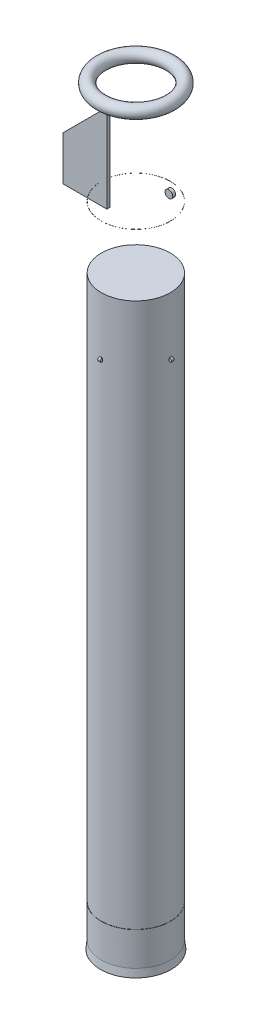
from build123d import *

# Parameters (mm, degrees)
SKETCH6_R             = 220
BOSS_EXTRUDE1_DEPTH   = 160
CIRPATTERN1_COUNT     = 4
SKETCH8_R             = 500
BOSS_EXTRUDE2_DEPTH   = 190
BOSS_EXTRUDE2_2_DEPTH = 190
SKETCH10_R            = 10
SKETCH10_R_2          = 6
SKETCH10_R_3          = 800


with BuildPart() as part:
    # Sketch1 → Revolve1 (revolve)
    with BuildSketch(Plane.XY, mode=Mode.PRIVATE) as revolve1_sk:
        Polygon((0, 76500), (4500, 76500), (4500, 1000), (4620, 0), (4300, 0), (4300, 1500), (4300, 73000), (0, 75000), align=None)
    revolve(revolve1_sk.sketch.rotate(Axis((0, 0, 0), (0, 1, 0)), 90), axis=Axis((0, 0, 0), (0, 1, 0)))

    # Sketch6 → Boss-Extrude1 (add, symmetric)
    with BuildSketch(Plane.XY):
        with Locations((4600, 69000)):
            Circle(SKETCH6_R)
    boss_extrude1 = extrude(amount=BOSS_EXTRUDE1_DEPTH, both=True)

    # CirPattern1: Boss-Extrude1 ×4 about axis
    cirpattern1_axis = Axis((0, 0, 0), (0, 1, 0))
    for i in range(1, CIRPATTERN1_COUNT):
        add(boss_extrude1.rotate(cirpattern1_axis, i * 360 / CIRPATTERN1_COUNT))



with BuildPart() as body_2:
    # Sketch8 → Boss-Extrude2 (new, symmetric)
    with BuildSketch(Plane.XY):
        with Locations((4500, 87750)):
            Circle(SKETCH8_R)
    extrude(amount=BOSS_EXTRUDE2_DEPTH, both=True)


with BuildPart() as body_3:
    # Sketch8 → Boss-Extrude2 2 (new, symmetric)
    with BuildSketch(Plane.XY):
        Polygon((-3600, 93500), (-9350, 87750), (-9350, 82000), (-3600, 82000), align=None)
    extrude(amount=BOSS_EXTRUDE2_2_DEPTH, both=True)


with BuildPart() as part_1:
    add(part.part)

    add(body_3.part)  # Revolve6 merges body 3
    # Sketch10 → Revolve6 (revolve)
    with BuildSketch(Plane.XY, mode=Mode.PRIVATE) as revolve6_sk:
        with Locations((4506, 5400)):
            Circle(SKETCH10_R)
        with Locations((4500, 84600)):
            Circle(SKETCH10_R_2)
        with Locations((4500, 98000)):
            Circle(SKETCH10_R_3)
    revolve(revolve6_sk.sketch.rotate(Axis((0, 0, 0), (0, 1, 0)), 90), axis=Axis((0, 0, 0), (0, 1, 0)))


solid = Compound([body_2.part, part_1.part])
